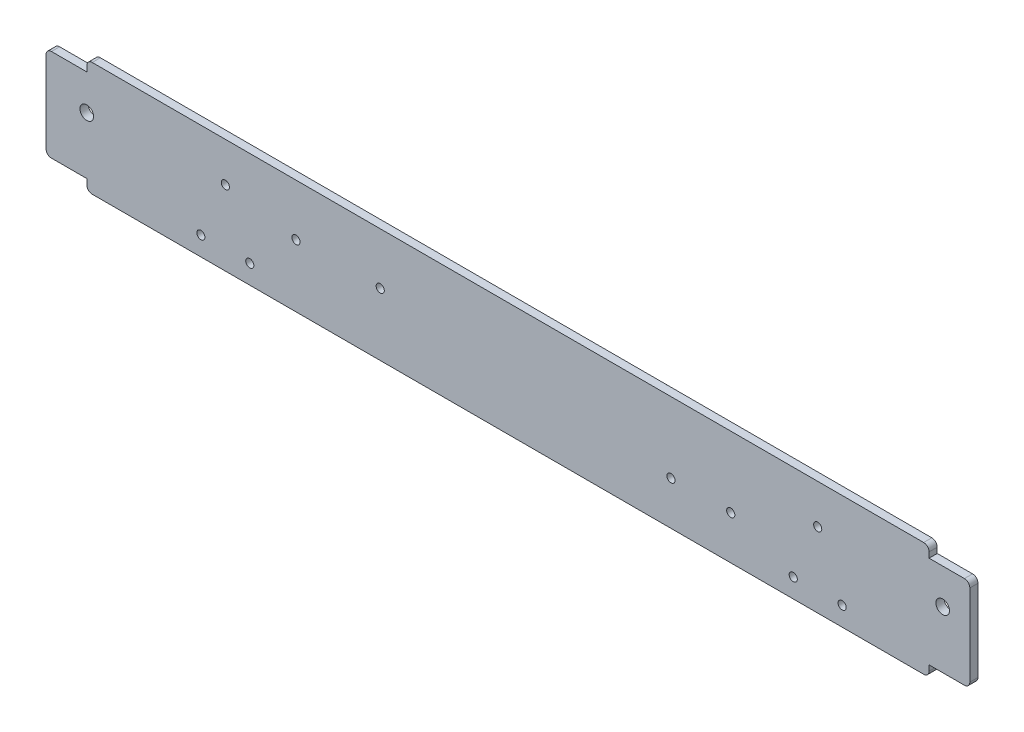
from build123d import *

# Parameters (mm, degrees)
CROQUIS1_W                                 = 340
CROQUIS1_H                                 = 42
CROQUIS1_R                                 = 1.5
CROQUIS1_R_2                               = 2.5
SALIENTE_EXTRUIR1_DEPTH                    = 3
CROQUIS2_W                                 = 15
CROQUIS2_H                                 = 4
CORTAR_EXTRUIR2_DEPTH                      = 172.31841699
SIMETR_A4_AT_THE_SECOND_PLANE_COPY_1_SKE_W = 15
SIMETR_A4_AT_THE_SECOND_PLANE_COPY_1_SKE_H = 4
SIMETR_A4_AT_THE_SECOND_PLANE_COPY_1_DEPTH = 172.31841699
REDONDEO1_R                                = 2


with BuildPart() as part:
    # Croquis1 → Saliente-Extruir1 (new body)
    with BuildSketch(Plane.XY):
        Rectangle(CROQUIS1_W, CROQUIS1_H)
        with Locations((-47, 2)):
            Circle(CROQUIS1_R, mode=Mode.SUBTRACT)
        with Locations((-78, 2)):
            Circle(CROQUIS1_R, mode=Mode.SUBTRACT)
        with Locations((-104, 6.5)):
            Circle(CROQUIS1_R, mode=Mode.SUBTRACT)
        with Locations((-113, -14)):
            Circle(CROQUIS1_R, mode=Mode.SUBTRACT)
        with Locations((-95, -14)):
            Circle(CROQUIS1_R, mode=Mode.SUBTRACT)
        with Locations((-155, 4)):
            Circle(CROQUIS1_R_2, mode=Mode.SUBTRACT)
        with Locations((160, 4)):
            Circle(CROQUIS1_R_2, mode=Mode.SUBTRACT)
        with Locations((114, 6.5)):
            Circle(CROQUIS1_R, mode=Mode.SUBTRACT)
        with Locations((105, -14)):
            Circle(CROQUIS1_R, mode=Mode.SUBTRACT)
        with Locations((123, -14)):
            Circle(CROQUIS1_R, mode=Mode.SUBTRACT)
        with Locations((82, -5)):
            Circle(CROQUIS1_R, mode=Mode.SUBTRACT)
        with Locations((60, -5)):
            Circle(CROQUIS1_R, mode=Mode.SUBTRACT)
    extrude(amount=SALIENTE_EXTRUIR1_DEPTH)

    # Croquis2 → Cortar-Extruir2 (cut, through all)
    with BuildSketch(Plane.XY.offset(3)):
        with Locations((-162.5, -19)):
            Rectangle(CROQUIS2_W, CROQUIS2_H)
    cortar_extruir2 = extrude(amount=-CORTAR_EXTRUIR2_DEPTH, mode=Mode.SUBTRACT)

    # Simetría4: Cortar-Extruir2 across plane
    add(cortar_extruir2.mirror(Plane(origin=(0, 0, 0), x_dir=(0, 0, 1), z_dir=(1, 0, 0))), mode=Mode.SUBTRACT)

    # Simetría4 at the second plane: Cortar-Extruir2 across plane
    add(cortar_extruir2.mirror(Plane.ZX), mode=Mode.SUBTRACT)

    # Simetría4 at the second plane copy 1 ske → Simetría4 at the second plane copy 1 (cut, through all)
    with BuildSketch(Plane(origin=(0, 0, 3), x_dir=(-1, 0, 0), z_dir=(0, 0, 1))):
        with Locations((-162.5, -19)):
            Rectangle(SIMETR_A4_AT_THE_SECOND_PLANE_COPY_1_SKE_W, SIMETR_A4_AT_THE_SECOND_PLANE_COPY_1_SKE_H)
    extrude(amount=-SIMETR_A4_AT_THE_SECOND_PLANE_COPY_1_DEPTH, mode=Mode.SUBTRACT)

    # Redondeo1
    redondeo1_edges = [part.edges().sort_by_distance(p)[0] for p in [
        (155, -21, 1.5),
        (170, 17, 1.5),
        (155, 21, 1.5),
        (-170, -17, 1.5),
        (-155, -21, 1.5),
        (-170, 17, 1.5),
        (-155, 21, 1.5),
        (170, -17, 1.5),
    ]]
    fillet(redondeo1_edges, radius=REDONDEO1_R)


solid = part.part
